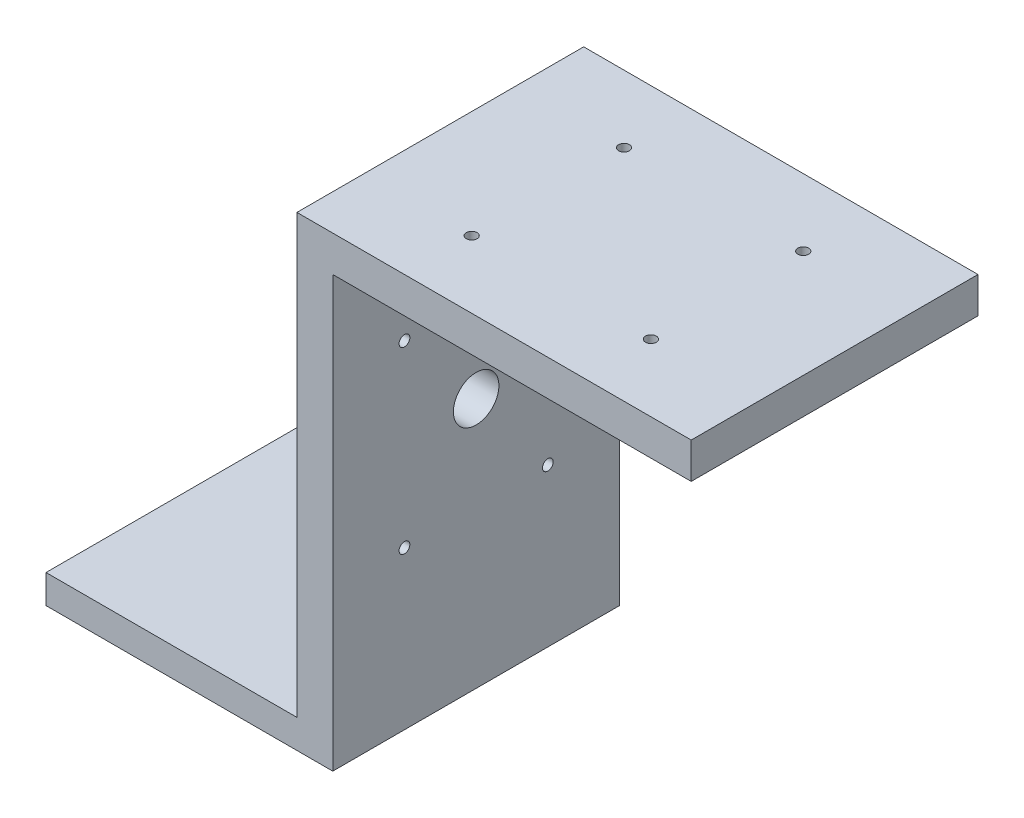
from build123d import *

# Parameters (mm, degrees)
BOSS_EXTRUDE1_DEPTH = 20
MOVE_FACE1_BY       = 10
MOVE_FACE2_BY       = 10
SKETCH2_R           = 0.75
CUT_EXTRUDE1_DEPTH  = 88.464278423
SKETCH3_R           = 0.75
CUT_EXTRUDE2_DEPTH  = 108.819293264
SKETCH5_R           = 3.175
CUT_EXTRUDE3_DEPTH  = 88.464278423


with BuildPart() as part:
    # Sketch1 → Boss-Extrude1 (new, symmetric)
    with BuildSketch(Plane.XY):
        Polygon((0, 0), (-40, 0), (-40, 4), (-5, 4), (-5, 55), (50, 55), (50, 50), (0, 50), align=None)
    extrude(amount=BOSS_EXTRUDE1_DEPTH, both=True)

    # Move Face1: a face moved outward by 10.0
    extrude(part.faces().sort_by_distance((22.5, 55, 0))[0], amount=MOVE_FACE1_BY, dir=(0, 1, 0))

    # Move Face2: a face moved inward by 10.0
    extrude(part.faces().sort_by_distance((25, 50, 0))[0], amount=MOVE_FACE2_BY, dir=(0, 1, 0), mode=Mode.SUBTRACT)

    # Sketch2 → Cut-Extrude1 (cut, through all)
    with BuildSketch(Plane.ZY.offset(5)):
        with Locations((-10, 22)):
            Circle(SKETCH2_R)
        with Locations((10, 22)):
            Circle(SKETCH2_R)
        with Locations((10, 47)):
            Circle(SKETCH2_R)
        with Locations((-10, 47)):
            Circle(SKETCH2_R)
    extrude(amount=-CUT_EXTRUDE1_DEPTH, mode=Mode.SUBTRACT)

    # Sketch3 → Cut-Extrude2 (cut, through all)
    with BuildSketch(Plane(origin=(0, 65, -50), x_dir=(1, 0, 0), z_dir=(0, -1, 0))):
        with Locations(Location((10, 39.375, 0), (0, 0, 180))):
            Circle(SKETCH3_R)
        with Locations(Location((35, 39.375, 0), (0, 0, 90))):
            Circle(SKETCH3_R)
        with Locations(Location((35, 60.625, 0), (0, 0, 180))):
            Circle(SKETCH3_R)
        with Locations(Location((10, 60.625, 0), (0, 0, 90))):
            Circle(SKETCH3_R)
    extrude(amount=CUT_EXTRUDE2_DEPTH, mode=Mode.SUBTRACT)

    # Sketch5 → Cut-Extrude3 (cut, through all)
    with BuildSketch(Plane.ZY.offset(5)):
        with Locations(Location((0, 35, 0), (0, 0, 270))):
            Circle(SKETCH5_R)
    extrude(amount=-CUT_EXTRUDE3_DEPTH, mode=Mode.SUBTRACT)


solid = part.part
